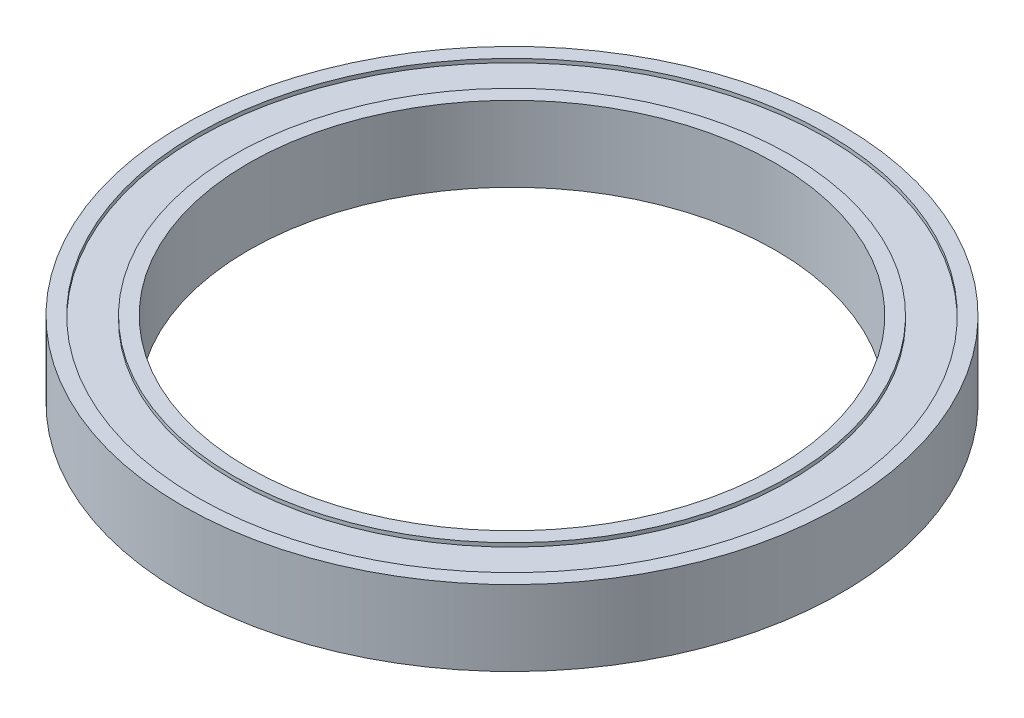
from build123d import *


with BuildPart() as part:
    # 草图2 → 旋转1 (revolve)
    with BuildSketch(Plane.XY, mode=Mode.PRIVATE) as revolve_1_sk:
        Polygon((14, 2), (14, -2), (14.777777778, -2), (14.777777778, -1.8), (16.722222222, -1.8), (16.722222222, -2), (17.5, -2), (17.5, 2), (16.722222222, 2), (16.722222222, 1.8), (14.777777778, 1.8), (14.777777778, 2), align=None)
    revolve(revolve_1_sk.sketch.rotate(Axis((0, 0, 0), (0, 1, 0)), 90), axis=Axis((0, 0, 0), (0, 1, 0)))


solid = part.part
